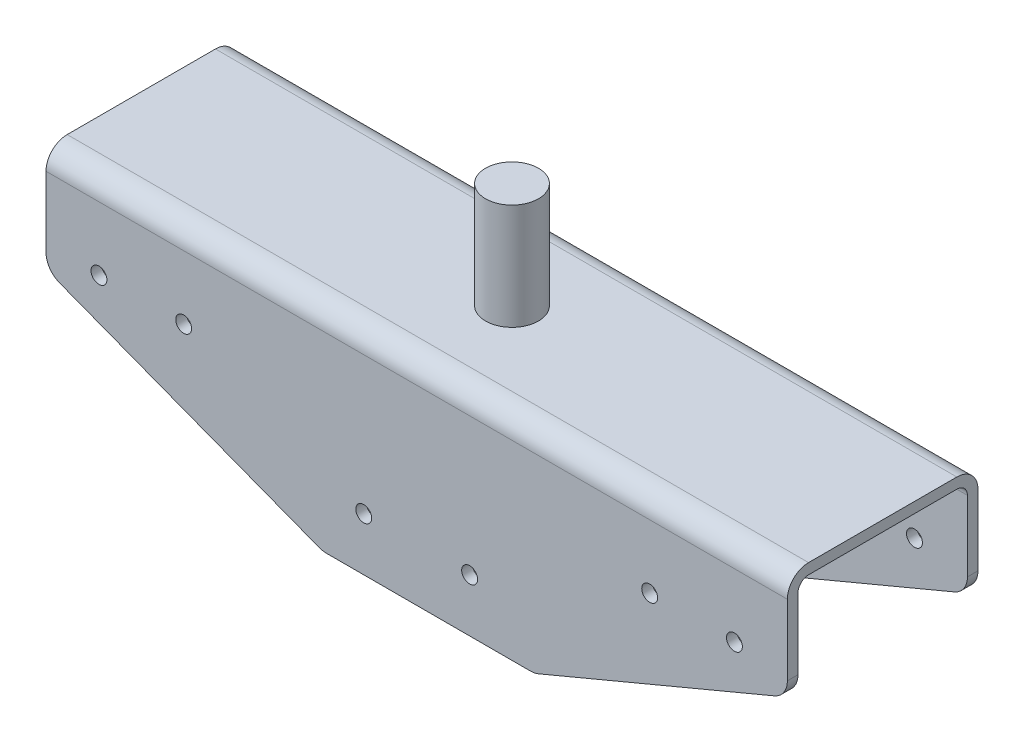
from build123d import *

# Parameters (mm, degrees)
BOSS_EXTRUDE1_DEPTH     = 9
FILLET1_R               = 2
CUT_EXTRUDE1_DEPTH      = 38.496666519
CUT_EXTRUDE1_DEPTH_BACK = 38.496666519
SKETCH3_R               = 2.5
BOSS_EXTRUDE2_DEPTH     = 10
CUT_EXTRUDE2_DEPTH      = 42.303752856
CUT_EXTRUDE2_DEPTH_BACK = 42.303752856
SKETCH4_R               = 0.75
SKETCH5_W               = 1
SKETCH5_H               = 10
BOSS_EXTRUDE3_DEPTH     = 10


with BuildPart() as part:
    # Sketch1 → Boss-Extrude1 (new, symmetric)
    with BuildSketch(Plane.XY):
        with BuildLine():
            ThreePointArc((-33.714795211, -0.491812162), (-34.647663561, 0.242423764), (-35, 1.376092494))
            Line((-35, 1.376092494), (-35, 10))
            Line((-35, 10), (35, 10))
            Line((35, 10), (35, 1.330500849))
            ThreePointArc((35, 1.330500849), (34.665188238, 0.222733667), (33.772851869, -0.514140034))
            Line((33.772851869, -0.514140034), (11.50283608, -9.844640883))
            ThreePointArc((11.50283608, -9.844640883), (11.12414042, -9.960775582), (10.729984211, -10))
            Line((10.729984211, -10), (-8.498371341, -10))
            ThreePointArc((-8.498371341, -10), (-8.861820571, -9.966698924), (-9.213166552, -9.867904657))
            Line((-9.213166552, -9.867904657), (-33.714795211, -0.491812162))
        make_face()
    extrude(amount=BOSS_EXTRUDE1_DEPTH, both=True)

    # Fillet1
    fillet1_edges = [part.edges().sort_by_distance(p)[0] for p in [
        (0, 10, -9),
        (0, 10, 9),
    ]]
    fillet(fillet1_edges, radius=FILLET1_R)

    # Sketch2 → Cut-Extrude1 (cut, two sides: drawn at the far end of the back side and taken through both)
    with BuildSketch(Plane(origin=(0, 0, 0), x_dir=(0, 0, -1), z_dir=(1, 0, 0)).offset(-CUT_EXTRUDE1_DEPTH_BACK)):
        with BuildLine():
            Line((-8, 8), (-8, -14.234256749))
            Line((-8, -14.234256749), (8, -14.234256749))
            Line((8, -14.234256749), (8, 1.330500849))
            Line((8, 1.330500849), (8, 8))
            ThreePointArc((8, 8), (7.707106781, 8.707106781), (7, 9))
            Line((7, 9), (-7, 9))
            ThreePointArc((-7, 9), (-7.707106781, 8.707106781), (-8, 8))
        make_face()
    extrude(amount=CUT_EXTRUDE1_DEPTH + CUT_EXTRUDE1_DEPTH_BACK, mode=Mode.SUBTRACT)

    # Sketch3 → Boss-Extrude2 (add)
    with BuildSketch(Plane(origin=(0, 10, 0), x_dir=(1, 0, 0), z_dir=(0, 1, 0))):
        with Locations(Location((0, 0, 0), (0, 0, 270))):
            Circle(SKETCH3_R)
    extrude(amount=BOSS_EXTRUDE2_DEPTH)

    # Sketch4 → Cut-Extrude2 (cut, two sides: drawn at the far end of the back side and taken through both)
    with BuildSketch(Plane.XY.offset(-CUT_EXTRUDE2_DEPTH_BACK)):
        with Locations((-30, 2)):
            Circle(SKETCH4_R)
        with Locations((-22, 2)):
            Circle(SKETCH4_R)
        with Locations((-5, -5)):
            Circle(SKETCH4_R)
        with Locations(Location((5, -5, 0), (0, 0, 180))):
            Circle(SKETCH4_R)
        with Locations(Location((22, 2, 0), (0, 0, 180))):
            Circle(SKETCH4_R)
        with Locations(Location((30, 2, 0), (0, 0, 180))):
            Circle(SKETCH4_R)
    extrude(amount=CUT_EXTRUDE2_DEPTH + CUT_EXTRUDE2_DEPTH_BACK, mode=Mode.SUBTRACT)

    # Sketch5 → Boss-Extrude3 (add)
    with BuildSketch(Plane.XZ.offset(-9)):
        with Locations((0.5, 0)):
            Rectangle(SKETCH5_W, SKETCH5_H)
    extrude(amount=BOSS_EXTRUDE3_DEPTH)


solid = part.part
